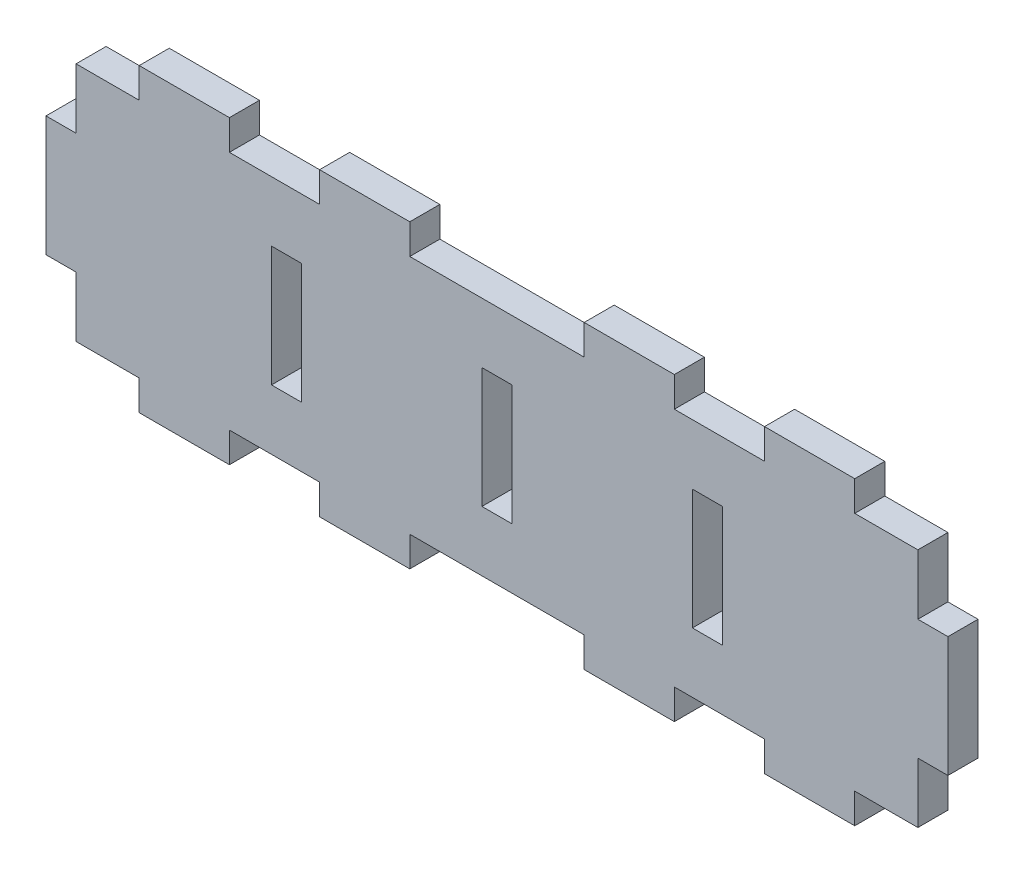
from build123d import *

# Parameters (mm, degrees)
SKETCH1_W           = 5
SKETCH1_H           = 20
BOSS_EXTRUDE1_DEPTH = 5


with BuildPart() as part:
    # Sketch1 → Boss-Extrude1 (new body)
    with BuildSketch(Plane.XY):
        Polygon((-70, 20), (-59.5, 20), (-59.5, 25), (-44.5, 25), (-44.5, 20), (-29.5, 20), (-29.5, 25), (-14.5, 25), (-14.5, 20), (14.5, 20), (14.5, 25), (29.5, 25), (29.5, 20), (44.5, 20), (44.5, 25), (59.5, 25), (59.5, 20), (70, 20), (70, 10), (75, 10), (75, -10), (70, -10), (70, -20), (59.5, -20), (59.5, -25), (44.5, -25), (44.5, -20), (29.5, -20), (29.5, -25), (14.5, -25), (14.5, -20), (-14.5, -20), (-14.5, -25), (-29.5, -25), (-29.5, -20), (-44.5, -20), (-44.5, -25), (-59.5, -25), (-59.5, -20), (-70, -20), (-70, -10), (-75, -10), (-75, 10), (-70, 10), align=None)
        with Locations((35, 0)):
            Rectangle(SKETCH1_W, SKETCH1_H, mode=Mode.SUBTRACT)
        Rectangle(SKETCH1_W, SKETCH1_H, mode=Mode.SUBTRACT)
        with Locations((-35, 0)):
            Rectangle(SKETCH1_W, SKETCH1_H, mode=Mode.SUBTRACT)
    extrude(amount=BOSS_EXTRUDE1_DEPTH)


solid = part.part
